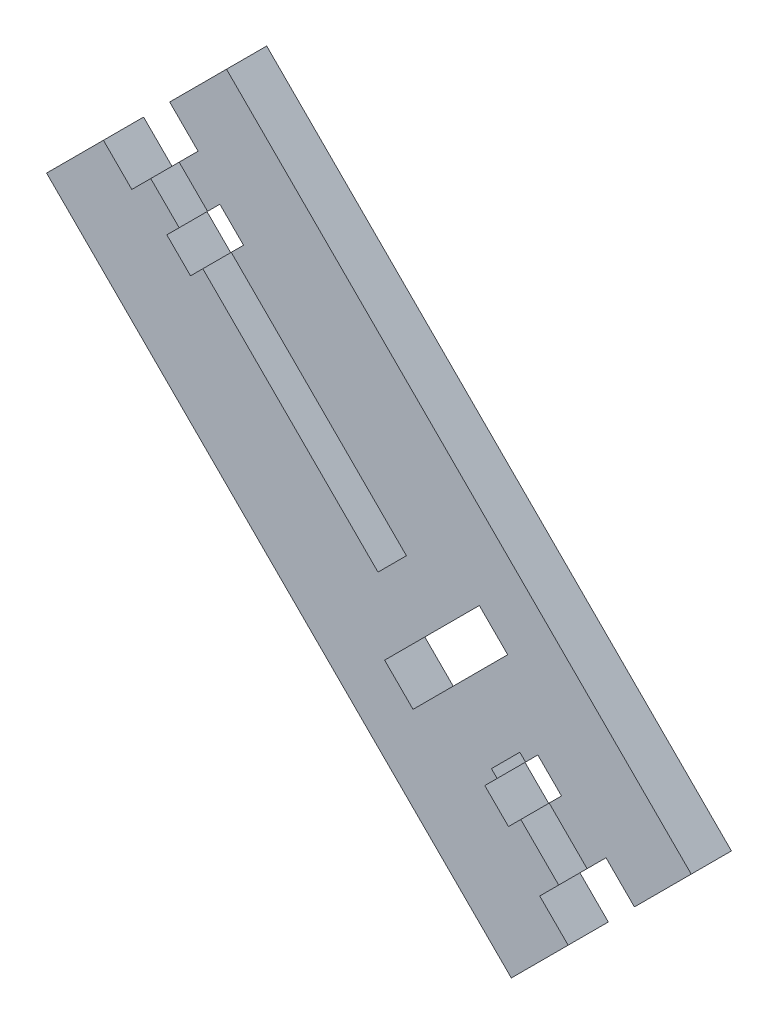
from build123d import *

# Parameters (mm, degrees)
EXTRUDE_1_DEPTH = 3


with BuildPart() as part:
    # 草圖1 → 填料-伸長1 (new body)
    with BuildSketch(Plane.XY):
        Polygon((95.316243785, 66.254329164), (94.397004969, 65.335090349), (96.164771922, 63.567323396), (97.084010738, 64.486562211), (110.16548619, 51.405086759), (112.286806533, 53.526407103), (99.205331081, 66.607882555), (100.124569897, 67.52712137), (98.356802944, 69.294888323), (97.437564128, 68.375649508), (95.316243785, 70.496969851), (96.730457347, 71.911183414), (94.609137003, 74.032503757), (98.851777691, 78.275144444), (133.556578511, 43.570343624), (129.313937824, 39.327702937), (127.192617481, 41.44902328), (125.778403918, 40.034809718), (122.949976793, 42.863236843), (123.869215609, 43.782475658), (122.101448656, 45.550242611), (121.18220984, 44.631003796), (120.757945772, 45.055267864), (118.636625428, 42.933947521), (119.060889497, 42.509683452), (118.141650681, 41.590444636), (119.909417634, 39.822677684), (120.82865645, 40.741916499), (123.657083575, 37.913489374), (122.242870012, 36.499275812), (124.364105937, 34.378039887), (120.121426288, 30.135438162), (85.416748848, 64.840115602), (89.659389535, 69.082756289), (91.780709879, 66.961435945), (93.194923441, 68.375649508), align=None)
        Polygon((117.731458038, 53.031361645), (110.660460936, 45.960364544), (112.78178128, 43.839044201), (119.852778381, 50.910041302), align=None, mode=Mode.SUBTRACT)
    extrude(amount=EXTRUDE_1_DEPTH)


solid = part.part
